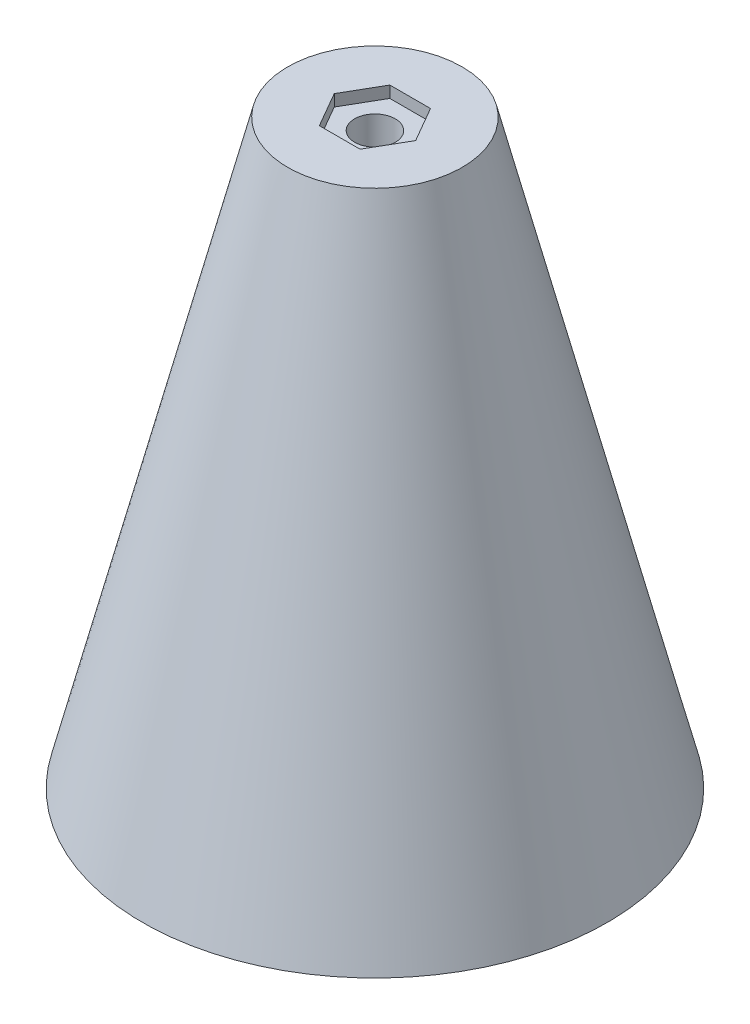
from build123d import *

# Parameters (mm, degrees)
SKETCH_4_R          = 1.75
CUT_EXTRUDE_1_DEPTH = 10
CUT_EXTRUDE_2_DEPTH = 1
CHAMFER_1_SIZE      = 0.5


with BuildPart() as part:
    # 草图3 → 旋转1 (revolve)
    with BuildSketch(Plane(origin=(0, 0, 0), x_dir=(0, 0, -1), z_dir=(1, 0, 0)), mode=Mode.PRIVATE) as revolve_1_sk:
        Polygon((-7.5, 0), (0, 0), (0, -4), (-4.5, -4), (-16, -50), (-20, -50), align=None)
    revolve(revolve_1_sk.sketch.rotate(Axis((0, 28.450677981, 0), (0, 1, 0)), 180), axis=Axis((0, 28.450677981, 0), (0, 1, 0)))

    # 草图4 → 切除-拉伸1 (cut)
    with BuildSketch(Plane(origin=(0, 0, 0), x_dir=(1, 0, 0), z_dir=(0, 1, 0))):
        with Locations(Location((0, 0, 0), (0, 0, 270))):
            Circle(SKETCH_4_R)
    extrude(amount=-CUT_EXTRUDE_1_DEPTH, mode=Mode.SUBTRACT)

    # 草图5 → 切除-拉伸2 (cut)
    with BuildSketch(Plane(origin=(0, 0, 0), x_dir=(1, 0, 0), z_dir=(0, 1, 0))):
        Polygon((3.5, 0), (1.75, 3.031088913), (-1.75, 3.031088913), (-3.5, 0), (-1.75, -3.031088913), (1.75, -3.031088913), align=None)
    extrude(amount=-CUT_EXTRUDE_2_DEPTH, mode=Mode.SUBTRACT)

    # 倒角1
    chamfer_1_edges = [part.edges().sort_by_distance(p)[0] for p in [
        (0, -4, -1.75),
    ]]
    chamfer(chamfer_1_edges, length=CHAMFER_1_SIZE)


solid = part.part
